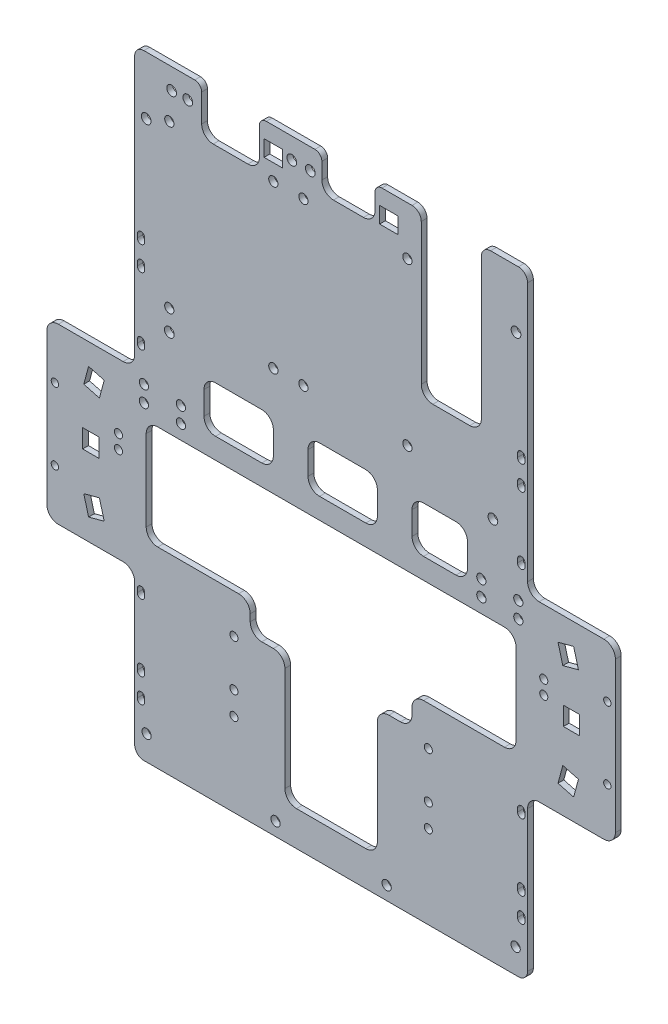
from build123d import *

# Parameters (mm, degrees)
SKETCH_1_W           = 70
SKETCH_1_H           = 13
EXTRUDE_1_DEPTH      = 2.5
CUT_EXTRUDE_1_DEPTH  = 10
SKETCH_3_R           = 2.1
CUT_EXTRUDE_2_DEPTH  = 10
FILLET_1_R           = 4
SKETCH_4_W           = 7
SKETCH_4_H           = 8
CUT_EXTRUDE_3_DEPTH  = 231.828389921
SKETCH_5_R           = 2
SKETCH_5_W           = 8
SKETCH_5_H           = 7
CUT_EXTRUDE_4_DEPTH  = 231.828389921
SKETCH_7_W           = 30
SKETCH_7_H           = 20
SKETCH_7_W_2         = 24
SKETCH_7_W_3         = 23
SKETCH_7_H_2         = 15
SKETCH_7_W_4         = 25
CUT_EXTRUDE_5_DEPTH  = 231.828389921
SKETCH_8_R           = 1.75
CUT_EXTRUDE_6_DEPTH  = 231.828389921
FILLET_2_R           = 3
SKETCH_11_R          = 2
CUT_EXTRUDE_9_DEPTH  = 10
FILLET_3_R           = 5
EXTRUDE_START        = 2.5
EXTRUDE_3_DEPTH      = 2.5
SKETCH_13_R          = 1.6
CUT_EXTRUDE_10_DEPTH = 237.333206474
SKETCH_14_R          = 1.75
SKETCH_14_R_2        = 2.1
CUT_EXTRUDE_11_DEPTH = 237.333206474


with BuildPart() as part:
    # 草图1 → 凸台-拉伸1 (new body)
    with BuildSketch(Plane.XY):
        Polygon((-126.727430556, 110.946180556), (-126.727430556, 48.446180556), (-156.727430556, 48.446180556), (-156.727430556, -26.553819444), (-126.727430556, -26.553819444), (-126.727430556, -96.553819444), (43.272569444, -96.553819444), (43.272569444, -26.553819444), (73.272569444, -26.553819444), (73.272569444, 48.446180556), (43.272569444, 48.446180556), (43.272569444, 123.446180556), (43.272569444, 169.446180556), (23.272569444, 169.446180556), (23.272569444, 99.446180556), (-2.727430556, 99.446180556), (-2.727430556, 169.446180556), (-126.727430556, 169.446180556), align=None)
        with Locations((-41.727430556, -20.053819444)):
            Rectangle(SKETCH_1_W, SKETCH_1_H, mode=Mode.SUBTRACT)
    extrude(amount=EXTRUDE_1_DEPTH)

    # 草图2 → 切除-拉伸1 (cut)
    with BuildSketch(Plane.XY.offset(2.5)):
        with BuildLine():
            Line((38.922569444, 99.446180556), (38.922569444, 97.846180556))
            ThreePointArc((38.922569444, 97.846180556), (40.522569444, 96.246180556), (42.122569444, 97.846180556))
            Line((42.122569444, 97.846180556), (42.122569444, 99.446180556))
            ThreePointArc((42.122569444, 99.446180556), (40.522569444, 101.046180556), (38.922569444, 99.446180556))
        make_face()
        with BuildLine():
            Line((38.922569444, 88.946180556), (38.922569444, 87.346180556))
            ThreePointArc((38.922569444, 87.346180556), (40.522569444, 85.746180556), (42.122569444, 87.346180556))
            Line((42.122569444, 87.346180556), (42.122569444, 88.946180556))
            ThreePointArc((42.122569444, 88.946180556), (40.522569444, 90.546180556), (38.922569444, 88.946180556))
        make_face()
        with BuildLine():
            Line((38.922569444, 59.946180556), (38.922569444, 58.346180556))
            ThreePointArc((38.922569444, 58.346180556), (40.522569444, 56.746180556), (42.122569444, 58.346180556))
            Line((42.122569444, 58.346180556), (42.122569444, 59.946180556))
            ThreePointArc((42.122569444, 59.946180556), (40.522569444, 61.546180556), (38.922569444, 59.946180556))
        make_face()
        with BuildLine():
            Line((38.922569444, -33.453819444), (38.922569444, -35.053819444))
            ThreePointArc((38.922569444, -35.053819444), (40.522569444, -36.653819444), (42.122569444, -35.053819444))
            Line((42.122569444, -35.053819444), (42.122569444, -33.453819444))
            ThreePointArc((42.122569444, -33.453819444), (40.522569444, -31.853819444), (38.922569444, -33.453819444))
        make_face()
        with BuildLine():
            Line((38.922569444, -62.453819444), (38.922569444, -64.053819444))
            ThreePointArc((38.922569444, -64.053819444), (40.522569444, -65.653819444), (42.122569444, -64.053819444))
            Line((42.122569444, -64.053819444), (42.122569444, -62.453819444))
            ThreePointArc((42.122569444, -62.453819444), (40.522569444, -60.853819444), (38.922569444, -62.453819444))
        make_face()
        with BuildLine():
            Line((38.922569444, -72.953819444), (38.922569444, -74.553819444))
            ThreePointArc((38.922569444, -74.553819444), (40.522569444, -76.153819444), (42.122569444, -74.553819444))
            Line((42.122569444, -74.553819444), (42.122569444, -72.953819444))
            ThreePointArc((42.122569444, -72.953819444), (40.522569444, -71.353819444), (38.922569444, -72.953819444))
        make_face()
        with BuildLine():
            Line((-125.577430556, -72.953819444), (-125.577430556, -74.553819444))
            ThreePointArc((-125.577430556, -74.553819444), (-123.977430556, -76.153819444), (-122.377430556, -74.553819444))
            Line((-122.377430556, -74.553819444), (-122.377430556, -72.953819444))
            ThreePointArc((-122.377430556, -72.953819444), (-123.977430556, -71.353819444), (-125.577430556, -72.953819444))
        make_face()
        with BuildLine():
            Line((-125.577430556, -62.453819444), (-125.577430556, -64.053819444))
            ThreePointArc((-125.577430556, -64.053819444), (-123.977430556, -65.653819444), (-122.377430556, -64.053819444))
            Line((-122.377430556, -64.053819444), (-122.377430556, -62.453819444))
            ThreePointArc((-122.377430556, -62.453819444), (-123.977430556, -60.853819444), (-125.577430556, -62.453819444))
        make_face()
        with BuildLine():
            Line((-125.577430556, -33.453819444), (-125.577430556, -35.053819444))
            ThreePointArc((-125.577430556, -35.053819444), (-123.977430556, -36.653819444), (-122.377430556, -35.053819444))
            Line((-122.377430556, -35.053819444), (-122.377430556, -33.453819444))
            ThreePointArc((-122.377430556, -33.453819444), (-123.977430556, -31.853819444), (-125.577430556, -33.453819444))
        make_face()
        with BuildLine():
            Line((-125.577430556, 59.946180556), (-125.577430556, 58.346180556))
            ThreePointArc((-125.577430556, 58.346180556), (-123.977430556, 56.746180556), (-122.377430556, 58.346180556))
            Line((-122.377430556, 58.346180556), (-122.377430556, 59.946180556))
            ThreePointArc((-122.377430556, 59.946180556), (-123.977430556, 61.546180556), (-125.577430556, 59.946180556))
        make_face()
        with BuildLine():
            Line((-125.577430556, 88.946180556), (-125.577430556, 87.346180556))
            ThreePointArc((-125.577430556, 87.346180556), (-123.977430556, 85.746180556), (-122.377430556, 87.346180556))
            Line((-122.377430556, 87.346180556), (-122.377430556, 88.946180556))
            ThreePointArc((-122.377430556, 88.946180556), (-123.977430556, 90.546180556), (-125.577430556, 88.946180556))
        make_face()
        with BuildLine():
            Line((-122.377430556, 99.446180556), (-122.377430556, 97.846180556))
            ThreePointArc((-122.377430556, 97.846180556), (-123.977430556, 96.246180556), (-125.577430556, 97.846180556))
            Line((-125.577430556, 97.846180556), (-125.577430556, 99.446180556))
            ThreePointArc((-125.577430556, 99.446180556), (-123.977430556, 101.046180556), (-122.377430556, 99.446180556))
        make_face()
    extrude(amount=-CUT_EXTRUDE_1_DEPTH, mode=Mode.SUBTRACT)

    # 草图3 → 切除-拉伸2 (cut)
    with BuildSketch(Plane.XY.offset(2.5)):
        with Locations((38.272569444, 144.446180556)):
            Circle(SKETCH_3_R)
        with Locations((-121.727430556, 144.446180556)):
            Circle(SKETCH_3_R)
        with Locations((28.272569444, 69.446180556)):
            Circle(SKETCH_3_R)
        with Locations((-111.727430556, 69.446180556)):
            Circle(SKETCH_3_R)
    extrude(amount=-CUT_EXTRUDE_2_DEPTH, mode=Mode.SUBTRACT)

    # 圆角1
    fillet_1_edges = [part.edges().sort_by_distance(p)[0] for p in [
        (-126.727430556, 169.446180556, 1.25),
        (-2.727430556, 169.446180556, 1.25),
        (23.272569444, 169.446180556, 1.25),
        (43.272569444, 169.446180556, 1.25),
        (73.272569444, 48.446180556, 1.25),
        (73.272569444, -26.553819444, 1.25),
        (43.272569444, -96.553819444, 1.25),
        (-126.727430556, -96.553819444, 1.25),
        (-156.727430556, -26.553819444, 1.25),
        (-156.727430556, 48.446180556, 1.25),
    ]]
    fillet(fillet_1_edges, radius=FILLET_1_R)

    # 草图4 → 切除-拉伸3 (cut, through all)
    with BuildSketch(Plane.XY.offset(2.5)):
        Polygon((-41.727430556, -13.553819444), (-121.727430556, -13.553819444), (-121.727430556, 31.446180556), (38.272569444, 31.446180556), (38.272569444, -13.553819444), align=None)
        with Locations((-145.727430556, 10.946180556)):
            Rectangle(SKETCH_4_W, SKETCH_4_H)
        Polygon((-141.965949772, -7.742086129), (-148.727430556, -9.553819444), (-146.656878195, -17.281226055), (-139.895397411, -15.469492739), align=None)
        Polygon((-139.895397411, 37.36185385), (-146.656878195, 39.173587166), (-148.727430556, 31.446180556), (-141.965949772, 29.63444724), align=None)
        Polygon((58.51108866, -7.742086129), (56.4405363, -15.469492739), (63.202017084, -17.281226055), (65.272569444, -9.553819444), align=None)
        with Locations((62.272569444, 10.946180556)):
            Rectangle(SKETCH_4_W, SKETCH_4_H)
        Polygon((58.51108866, 29.63444724), (56.4405363, 37.36185385), (63.202017084, 39.173587166), (65.272569444, 31.446180556), align=None)
        Polygon((-61.727430556, -26.553819444), (-61.727430556, -81.553819444), (-21.727430556, -81.553819444), (-21.727430556, -26.553819444), (-41.727430556, -26.553819444), align=None)
    extrude(amount=-CUT_EXTRUDE_3_DEPTH, mode=Mode.SUBTRACT)

    # 草图5 → 切除-拉伸4 (cut, through all)
    with BuildSketch(Plane.XY.offset(2.5)):
        with Locations((-8.727430556, 148.446180556)):
            Circle(SKETCH_5_R)
        with Locations((-53.727430556, 148.446180556)):
            Circle(SKETCH_5_R)
        with Locations((-66.727430556, 148.446180556)):
            Circle(SKETCH_5_R)
        with Locations((-111.727430556, 148.446180556)):
            Circle(SKETCH_5_R)
        with Locations((-8.727430556, 78.446180556)):
            Circle(SKETCH_5_R)
        with Locations((-53.727430556, 78.446180556)):
            Circle(SKETCH_5_R)
        with Locations((-66.727430556, 78.446180556)):
            Circle(SKETCH_5_R)
        with Locations((-111.727430556, 78.446180556)):
            Circle(SKETCH_5_R)
        with Locations((39.272569444, 44.446180556)):
            Circle(SKETCH_5_R)
        with Locations((23.272569444, 44.446180556)):
            Circle(SKETCH_5_R)
        with Locations((23.272569444, 37.66893042)):
            Circle(SKETCH_5_R)
        with Locations((39.272569444, 37.446180556)):
            Circle(SKETCH_5_R)
        with Locations(Location((-106.727430556, 37.66893042, 0), (0, 0, 180))):
            Circle(SKETCH_5_R)
        with Locations(Location((-106.727430556, 44.446180556, 0), (0, 0, 180))):
            Circle(SKETCH_5_R)
        with Locations(Location((-122.727430556, 37.446180556, 0), (0, 0, 180))):
            Circle(SKETCH_5_R)
        with Locations(Location((-122.727430556, 44.446180556, 0), (0, 0, 180))):
            Circle(SKETCH_5_R)
        with Locations((-16.727430556, 158.946180556)):
            Rectangle(SKETCH_5_W, SKETCH_5_H)
        with Locations((-66.727430556, 158.946180556)):
            Rectangle(SKETCH_5_W, SKETCH_5_H)
    extrude(amount=-CUT_EXTRUDE_4_DEPTH, mode=Mode.SUBTRACT)

    # 草图7 → 切除-拉伸5 (cut, through all)
    with BuildSketch(Plane.XY.offset(2.5)):
        with Locations((-36.727430556, 50.446180556)):
            Rectangle(SKETCH_7_W, SKETCH_7_H)
        with Locations((5.272569444, 50.446180556)):
            Rectangle(SKETCH_7_W_2, SKETCH_7_H)
        with Locations((-34.227430556, 161.946180556)):
            Rectangle(SKETCH_7_W_3, SKETCH_7_H_2)
        with Locations((-85.227430556, 159.446180556)):
            Rectangle(SKETCH_7_W_4, SKETCH_7_H)
        with Locations((-81.727430556, 50.446180556)):
            Rectangle(SKETCH_7_W, SKETCH_7_H)
    extrude(amount=-CUT_EXTRUDE_5_DEPTH, mode=Mode.SUBTRACT)

    # 草图8 → 切除-拉伸6 (cut, through all)
    with BuildSketch(Plane.XY.offset(2.5)):
        with Locations((0.322569444, -60.553819444)):
            Circle(SKETCH_8_R)
        with Locations((0.322569444, -50.553819444)):
            Circle(SKETCH_8_R)
        with Locations(Location((-83.777430556, -60.553819444, 0), (0, 0, 180))):
            Circle(SKETCH_8_R)
        with Locations(Location((-83.777430556, -50.553819444, 0), (0, 0, 180))):
            Circle(SKETCH_8_R)
        with Locations((0.322569444, -30.553819444)):
            Circle(SKETCH_8_R)
        with Locations(Location((-83.777430556, -30.553819444, 0), (0, 0, 180))):
            Circle(SKETCH_8_R)
    extrude(amount=-CUT_EXTRUDE_6_DEPTH, mode=Mode.SUBTRACT)

    # 圆角2
    fillet_2_edges = [part.edges().sort_by_distance(p)[0] for p in [
        (-97.727430556, 169.446180556, 1.25),
        (-72.727430556, 169.446180556, 1.25),
        (-45.727430556, 169.446180556, 1.25),
        (-22.727430556, 169.446180556, 1.25),
    ]]
    fillet(fillet_2_edges, radius=FILLET_2_R)

    # 草图11 → 切除-拉伸9 (cut)
    with BuildSketch(Plane(origin=(0, 0, 0), x_dir=(-1, 0, 0), z_dir=(0, 0, -1))):
        with Locations((121.568406825, -85.902912669)):
            Circle(SKETCH_11_R)
        with Locations((65.755563833, -90.762001547)):
            Circle(SKETCH_11_R)
        with Locations((17.699297278, -90.762001547)):
            Circle(SKETCH_11_R)
        with Locations((-38.113545714, -85.902912669)):
            Circle(SKETCH_11_R)
    extrude(amount=-CUT_EXTRUDE_9_DEPTH, mode=Mode.SUBTRACT)

    # 圆角3
    fillet_3_edges = [part.edges().sort_by_distance(p)[0] for p in [
        (-2.727430556, 99.446180556, 1.25),
        (23.272569444, 99.446180556, 1.25),
        (43.272569444, 48.446180556, 1.25),
        (43.272569444, -26.553819444, 1.25),
        (-126.727430556, -26.553819444, 1.25),
        (-126.727430556, 48.446180556, 1.25),
        (-61.727430556, -26.553819444, 1.25),
        (-21.727430556, -26.553819444, 1.25),
        (-21.727430556, -81.553819444, 1.25),
        (-61.727430556, -81.553819444, 1.25),
        (38.272569444, -13.553819444, 1.25),
        (-121.727430556, -13.553819444, 1.25),
        (-121.727430556, 31.446180556, 1.25),
        (38.272569444, 31.446180556, 1.25),
        (-76.727430556, -13.553819444, 1.25),
        (-76.727430556, -26.553819444, 1.25),
        (-6.727430556, -26.553819444, 1.25),
        (-6.727430556, -13.553819444, 1.25),
        (-66.727430556, 60.446180556, 1.25),
        (-66.727430556, 40.446180556, 1.25),
        (-96.727430556, 40.446180556, 1.25),
        (-96.727430556, 60.446180556, 1.25),
        (-72.727430556, 149.446180556, 1.25),
        (-97.727430556, 149.446180556, 1.25),
        (-22.727430556, 154.446180556, 1.25),
        (-45.727430556, 154.446180556, 1.25),
        (-6.727430556, 60.446180556, 1.25),
        (17.272569444, 60.446180556, 1.25),
        (17.272569444, 40.446180556, 1.25),
        (-6.727430556, 40.446180556, 1.25),
        (-21.727430556, 60.446180556, 1.25),
        (-21.727430556, 40.446180556, 1.25),
        (-51.727430556, 40.446180556, 1.25),
        (-51.727430556, 60.446180556, 1.25),
    ]]
    fillet(fillet_3_edges, radius=FILLET_3_R)

    # 草图12 → 凸台-拉伸3 (add)
    with BuildSketch(Plane.XY.offset(EXTRUDE_START)):
        with BuildLine():
            Line((-152.727430556, 48.446180556), (-159.727430556, 48.446180556))
            ThreePointArc((-159.727430556, 48.446180556), (-163.262964461, 46.981714461), (-164.727430556, 43.446180556))
            Line((-164.727430556, 43.446180556), (-164.727430556, -21.553819444))
            ThreePointArc((-164.727430556, -21.553819444), (-163.262964461, -25.08935335), (-159.727430556, -26.553819444))
            Line((-159.727430556, -26.553819444), (-152.727430556, -26.553819444))
            ThreePointArc((-152.727430556, -26.553819444), (-155.55585768, -25.382246569), (-156.727430556, -22.553819444))
            Line((-156.727430556, -22.553819444), (-156.727430556, 44.446180556))
            ThreePointArc((-156.727430556, 44.446180556), (-155.55585768, 47.27460768), (-152.727430556, 48.446180556))
        make_face()
        with BuildLine():
            Line((73.272569444, 44.446180556), (73.272569444, -22.553819444))
            ThreePointArc((73.272569444, -22.553819444), (72.100996569, -25.382246569), (69.272569444, -26.553819444))
            Line((69.272569444, -26.553819444), (76.272569444, -26.553819444))
            ThreePointArc((76.272569444, -26.553819444), (79.80810335, -25.08935335), (81.272569444, -21.553819444))
            Line((81.272569444, -21.553819444), (81.272569444, 43.446180556))
            ThreePointArc((81.272569444, 43.446180556), (79.80810335, 46.981714461), (76.272569444, 48.446180556))
            Line((76.272569444, 48.446180556), (69.272569444, 48.446180556))
            ThreePointArc((69.272569444, 48.446180556), (72.100996569, 47.27460768), (73.272569444, 44.446180556))
        make_face()
    extrude(amount=-EXTRUDE_3_DEPTH)

    # 草图13 → 切除-拉伸10 (cut, through all)
    with BuildSketch(Plane.XY.offset(2.5)):
        with Locations((77.772569444, 25.786180556)):
            Circle(SKETCH_13_R)
        with Locations((77.772569444, -5.243819444)):
            Circle(SKETCH_13_R)
        with Locations(Location((-161.227430556, 25.786180556, 0), (0, 0, 180))):
            Circle(SKETCH_13_R)
        with Locations(Location((-161.227430556, -5.243819444, 0), (0, 0, 180))):
            Circle(SKETCH_13_R)
    extrude(amount=-CUT_EXTRUDE_10_DEPTH, mode=Mode.SUBTRACT)

    # 草图14 → 切除-拉伸11 (cut, through all)
    with BuildSketch(Plane.XY.offset(2.5)):
        with Locations((-133.727430556, 20.446180556)):
            Circle(SKETCH_14_R)
        with Locations((-133.727430556, 14.446180556)):
            Circle(SKETCH_14_R)
        with Locations(Location((50.272569444, 14.446180556, 0), (0, 0, 180))):
            Circle(SKETCH_14_R)
        with Locations(Location((50.272569444, 20.446180556, 0), (0, 0, 180))):
            Circle(SKETCH_14_R)
        with Locations((-50.727430556, 160.446180556)):
            Circle(SKETCH_14_R_2)
        with Locations((-58.727430556, 160.446180556)):
            Circle(SKETCH_14_R_2)
        with Locations((-103.727430556, 160.446180556)):
            Circle(SKETCH_14_R_2)
        with Locations((-110.727430556, 160.446180556)):
            Circle(SKETCH_14_R_2)
    extrude(amount=-CUT_EXTRUDE_11_DEPTH, mode=Mode.SUBTRACT)


solid = part.part
